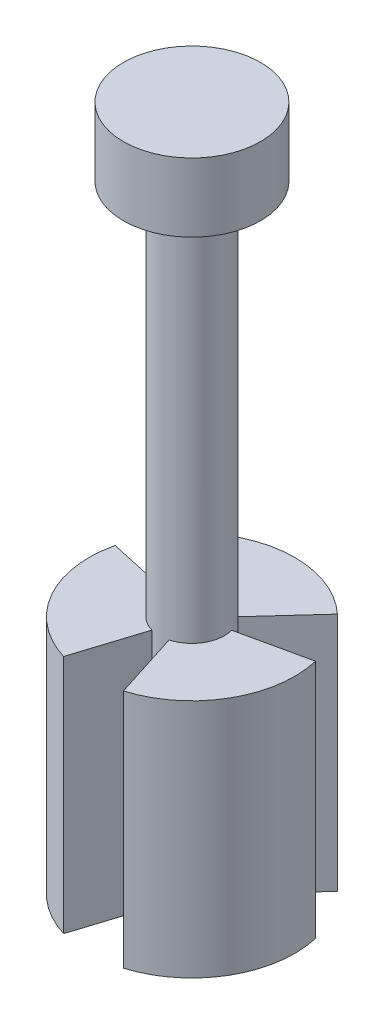
from build123d import *
from build123d.topology import SkipClean

# Parameters (mm, degrees)
SKETCH1_R           = 0.95
BOSS_EXTRUDE1_DEPTH = 20
SKETCH2_R           = 3
SKETCH2_R_2         = 0.95
BOSS_EXTRUDE2_DEPTH = 7
CUT_EXTRUDE1_DEPTH  = 14.674794331
CIRPATTERN1_COUNT   = 3
SKETCH5_R           = 2
BOSS_EXTRUDE3_DEPTH = 2


with BuildPart() as part:
    # Sketch1 → Boss-Extrude1 (new body)
    with BuildSketch(Plane(origin=(0, 0, 0), x_dir=(1, 0, 0), z_dir=(0, 1, 0))):
        with Locations(Location((0, 0, 0), (0, 0, 270))):
            Circle(SKETCH1_R)
    extrude(amount=BOSS_EXTRUDE1_DEPTH)

    # Sketch2 → Boss-Extrude2 (add)
    with BuildSketch(Plane.XZ):
        with Locations(Location((0, 0, 0), (0, 0, 270))):
            Circle(SKETCH2_R)
        with Locations(Location((0, 0, 0), (0, 0, 270))):
            Circle(SKETCH2_R_2, mode=Mode.SUBTRACT)
    extrude(amount=-BOSS_EXTRUDE2_DEPTH)

    # Sketch3 → Cut-Extrude1 (cut, through all)
    with SkipClean():  # the faces are left unmerged after this step: merging them gives an invalid solid
        with BuildSketch(Plane(origin=(0, 7, 0), x_dir=(1, 0, 0), z_dir=(0, 1, 0))):
            with BuildLine():
                Line((0.25, -0.916515139), (1.158545021, -3.775631426))
                Line((1.158545021, -3.775631426), (-1.158545021, -3.775631426))
                Line((-1.158545021, -3.775631426), (-0.25, -0.916515139))
                ThreePointArc((-0.25, -0.916515139), (0, -0.95), (0.25, -0.916515139))
            make_face()
        cut_extrude1 = extrude(amount=-CUT_EXTRUDE1_DEPTH, mode=Mode.SUBTRACT)

    # CirPattern1: Cut-Extrude1 ×3 about axis
    with SkipClean():  # the faces are left unmerged after this step: merging them gives an invalid solid
        cirpattern1_axis = Axis((0, 0, 0), (0, 1, 0))
        for i in range(1, CIRPATTERN1_COUNT):
            add(cut_extrude1.rotate(cirpattern1_axis, i * 360 / CIRPATTERN1_COUNT), mode=Mode.SUBTRACT)

    # Sketch5 → Boss-Extrude3 (add)
    with SkipClean():  # the faces are left unmerged after this step: merging them gives an invalid solid
        with BuildSketch(Plane(origin=(0, 18, 0), x_dir=(1, 0, 0), z_dir=(0, 1, 0))):
            with Locations(Location((0, 0, 0), (0, 0, 270))):
                Circle(SKETCH5_R)
        extrude(amount=BOSS_EXTRUDE3_DEPTH)


solid = part.part
